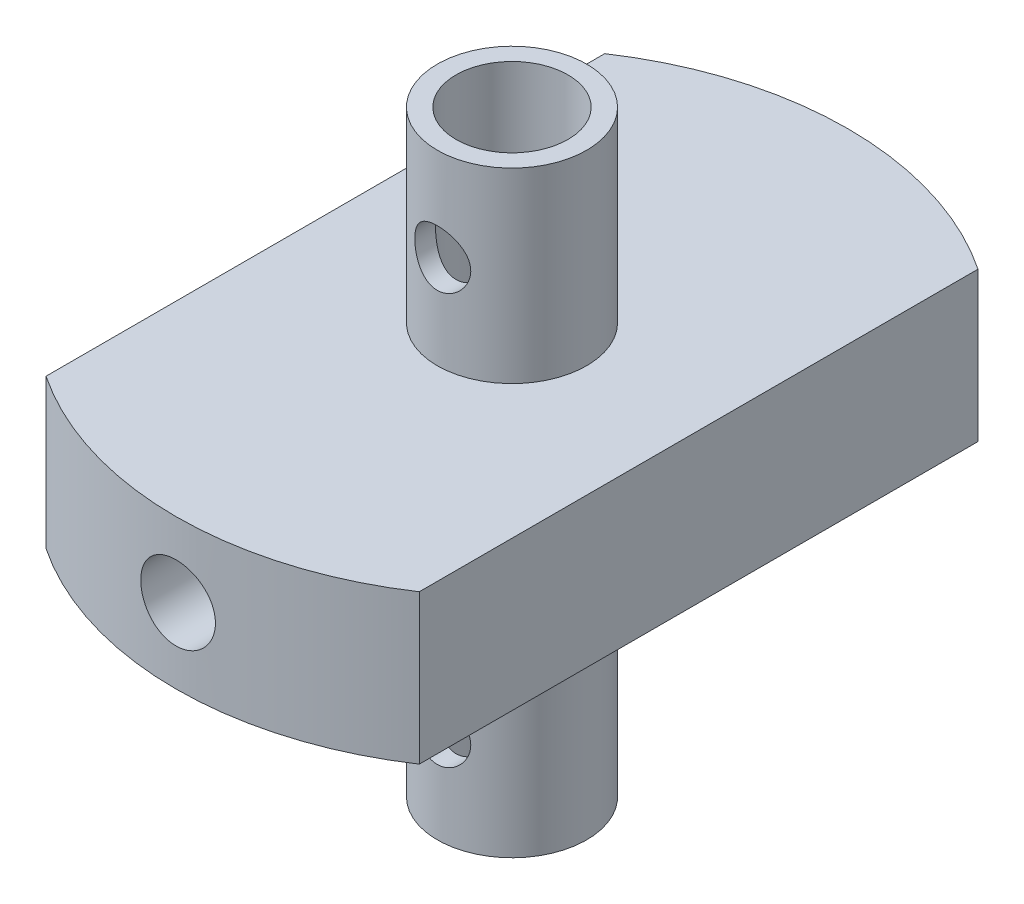
from build123d import *

# Parameters (mm, degrees)
SKETCH2_R               = 4
SKETCH2_R_2             = 3
BOSS_EXTRUDE1_DEPTH     = 10
CUT_EXTRUDE1_DEPTH      = 43.801869118
CUT_EXTRUDE1_DEPTH_BACK = 43.801869118
SKETCH3_R               = 1.5
SKETCH3_R_2             = 2
SKETCH4_W               = 13
SKETCH4_H               = 38
CUT_EXTRUDE2_DEPTH      = 10


with BuildPart() as part:
    # Sketch1 → Revolve1 (revolve)
    with BuildSketch(Plane.XY, mode=Mode.PRIVATE) as revolve1_sk:
        Polygon((3, 0), (4, 0), (4, 14), (18, 14), (18, 22), (0, 22), (0, 13), (3, 13), align=None)
    revolve(revolve1_sk.sketch.rotate(Axis((0, 0, 0), (0, 1, 0)), 90), axis=Axis((0, 0, 0), (0, 1, 0)))

    # Sketch2 → Boss-Extrude1 (add)
    with BuildSketch(Plane(origin=(0, 22, 0), x_dir=(1, 0, 0), z_dir=(0, 1, 0))):
        with Locations(Location((0, 0, 0), (0, 0, 90))):
            Circle(SKETCH2_R)
        with Locations(Location((0, 0, 0), (0, 0, 90))):
            Circle(SKETCH2_R_2, mode=Mode.SUBTRACT)
    extrude(amount=BOSS_EXTRUDE1_DEPTH)

    # Sketch3 → Cut-Extrude1 (cut, two sides: drawn at the far end of the back side and taken through both)
    with BuildSketch(Plane(origin=(0, 0, -4), x_dir=(-1, 0, 0), z_dir=(0, 0, -1)).offset(-CUT_EXTRUDE1_DEPTH_BACK)):
        with Locations((0, 5)):
            Circle(SKETCH3_R)
        with Locations((0, 27)):
            Circle(SKETCH3_R)
        with Locations((0, 18)):
            Circle(SKETCH3_R_2)
    extrude(amount=CUT_EXTRUDE1_DEPTH + CUT_EXTRUDE1_DEPTH_BACK, mode=Mode.SUBTRACT)

    # Sketch4 → Cut-Extrude2 (cut)
    with BuildSketch(Plane(origin=(0, 22, 0), x_dir=(1, 0, 0), z_dir=(0, 1, 0))):
        with Locations((-16.5, 0)):
            Rectangle(SKETCH4_W, SKETCH4_H)
        with Locations((16.5, 0)):
            Rectangle(SKETCH4_W, SKETCH4_H)
    extrude(amount=-CUT_EXTRUDE2_DEPTH, mode=Mode.SUBTRACT)


solid = part.part
